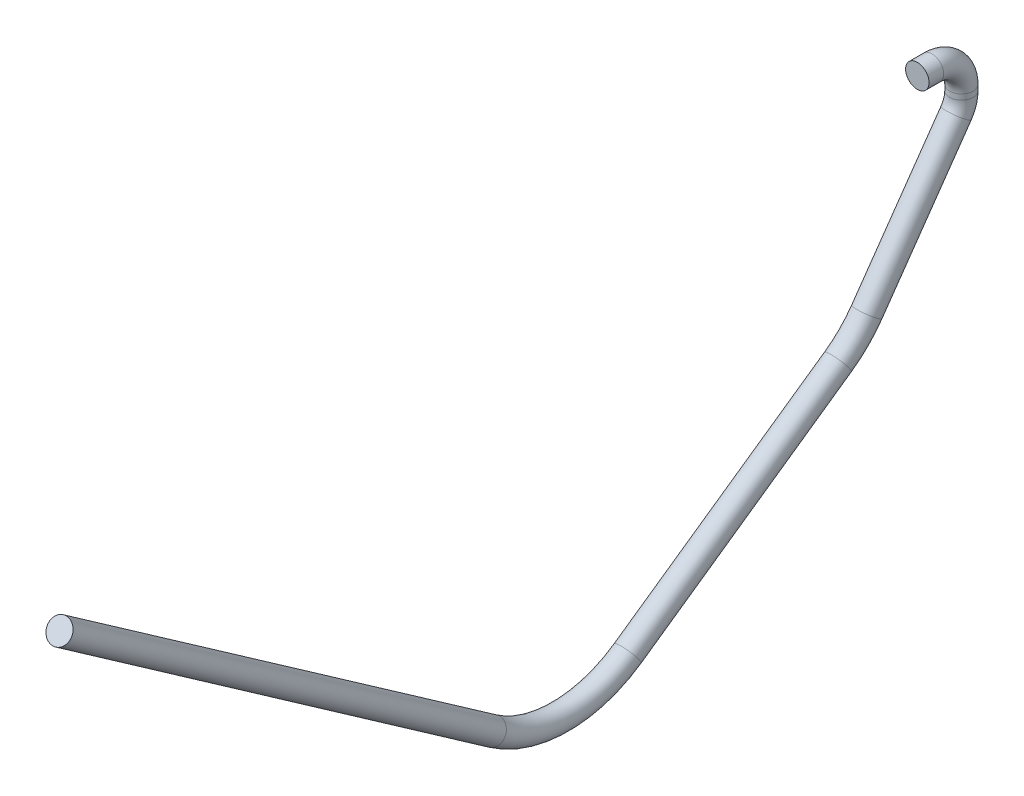
from build123d import *

# Parameters (mm, degrees)
SKETCH_1_R = 4


with BuildPart() as part:
    # 扫描1: sweep along a path in 草图2
    with BuildLine(Plane(origin=(0, 0, 0), x_dir=(0, 0, -1), z_dir=(1, 0, 0))) as sweep_1_path:
        Line((0, 0), (5, 0))
        ThreePointArc((5, 0), (12.071067812, -2.928932188), (15, -10))
        Line((15, -10), (15, -11.847012111))
        ThreePointArc((15, -11.847012111), (14.537169507, -14.854070106), (13.191520443, -17.582776475))
        Line((13.191520443, -17.582776475), (-17.177585689, -60.954354864))
        ThreePointArc((-17.177585689, -60.954354864), (-21.659396213, -66.295568657), (-27.000610007, -70.777379181))
        Line((-27.000610007, -70.777379181), (-98.528199032, -120.861536207))
        ThreePointArc((-98.528199032, -120.861536207), (-121.471256486, -128.095454435), (-144.41431394, -120.861536207))
        Line((-144.41431394, -120.861536207), (-291.861681912, -17.617777664))
    # 草图1 → 扫描1 (sweep)
    with BuildSketch(Plane.XY):
        Circle(SKETCH_1_R)
    sweep(path=sweep_1_path.line)


solid = part.part
